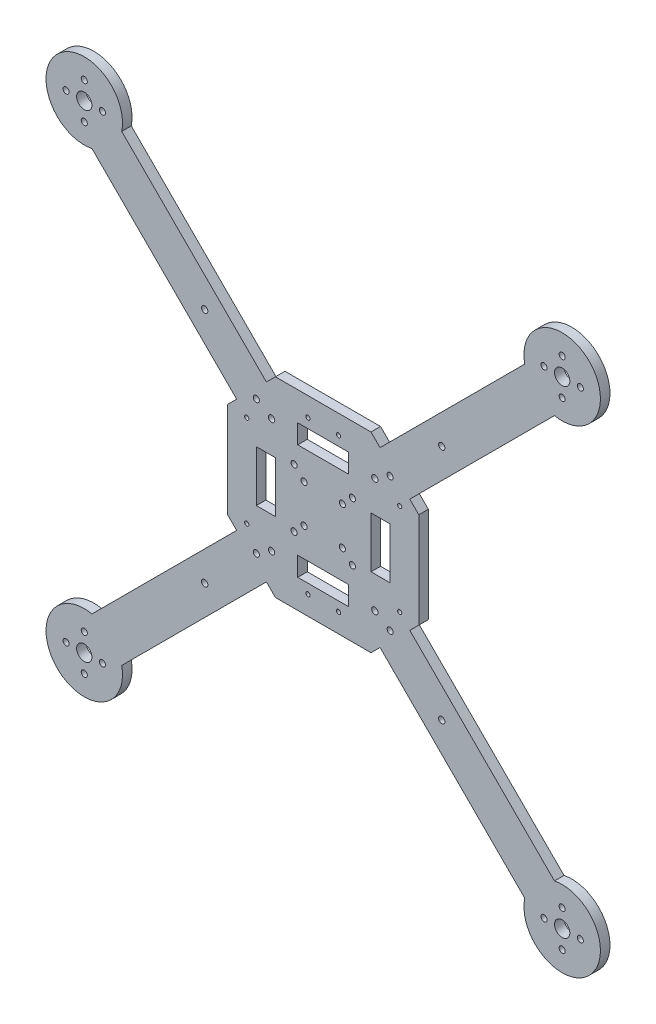
from build123d import *

# Parameters (mm, degrees)
EXTRUDE_246_DEPTH       = 5
EXTRUDE_363_DEPTH       = 5
SKETCH_3_R              = 20
EXTRUDE_433_DEPTH       = 5
SKETCH_4_R              = 4
SKETCH_4_R_2            = 1.6
SKETCH_4_R_3            = 1.1
CUT_EXTRUDE_574_DEPTH   = 5
SKETCH_5_R              = 1.1
CUT_EXTRUDE_636_DEPTH   = 5
SKETCH_7_R              = 1.65
CUT_EXTRUDE_M3_DEPTH    = 5
SKETCH_8_R              = 1.65
PIXHAWK_M3_54X60_DEPTH  = 5
SKETCH_9_W              = 10
SKETCH_9_H              = 26.682090866
SKETCH_9_W_2            = 26.682090866
SKETCH_9_H_2            = 10
CUT_EXTRUDE_20X12_DEPTH = 5


with BuildPart() as part:
    # 草图1 → Extrude 246 (new body)
    with BuildSketch(Plane.XY):
        Polygon((50, 25), (25, 50), (-25, 50), (-50, 25), (-50, -25), (-25, -50), (25, -50), (50, -25), align=None)
    extrude(amount=EXTRUDE_246_DEPTH)

    # 草图2 → Extrude 363 (add)
    with BuildSketch(Plane.XY):
        Polygon((14.849242405, 30.405591591), (120.050252532, 135.606601718), (135.606601718, 120.050252532), (30.405591591, 14.849242405), align=None)
        Polygon((-30.405591591, 14.849242405), (-135.606601718, 120.050252532), (-120.050252532, 135.606601718), (-14.849242405, 30.405591591), align=None)
        Polygon((-14.849242405, -30.405591591), (-120.050252532, -135.606601718), (-135.606601718, -120.050252532), (-30.405591591, -14.849242405), align=None)
        Polygon((30.405591591, -14.849242405), (135.606601718, -120.050252532), (120.050252532, -135.606601718), (14.849242405, -30.405591591), align=None)
    extrude(amount=EXTRUDE_363_DEPTH)

    # 草图3 → Extrude 433 (add)
    with BuildSketch(Plane.XY):
        with Locations((-125, -125)):
            Circle(SKETCH_3_R)
        with Locations((-125, 125)):
            Circle(SKETCH_3_R)
        with Locations((125, -125)):
            Circle(SKETCH_3_R)
        with Locations((125, 125)):
            Circle(SKETCH_3_R)
    extrude(amount=EXTRUDE_433_DEPTH)

    # 草图4 → Cut-Extrude 574 (cut)
    with BuildSketch(Plane.XY):
        with Locations((-125, -125)):
            Circle(SKETCH_4_R)
        with Locations((-35, -35)):
            Circle(SKETCH_4_R_2)
        with Locations((-8, -40)):
            Circle(SKETCH_4_R_3)
        with Locations((-125, 125)):
            Circle(SKETCH_4_R)
        with Locations((-35, 35)):
            Circle(SKETCH_4_R_2)
        with Locations((-8, 40)):
            Circle(SKETCH_4_R_3)
        with Locations((125, -125)):
            Circle(SKETCH_4_R)
        with Locations((35, -35)):
            Circle(SKETCH_4_R_2)
        with Locations((8, -40)):
            Circle(SKETCH_4_R_3)
        with Locations((125, 125)):
            Circle(SKETCH_4_R)
        with Locations((35, 35)):
            Circle(SKETCH_4_R_2)
        with Locations((8, 40)):
            Circle(SKETCH_4_R_3)
        with Locations((-15.25, -15.25)):
            Circle(SKETCH_4_R_2)
        with Locations((-15.25, 15.25)):
            Circle(SKETCH_4_R_2)
        with Locations((15.25, -15.25)):
            Circle(SKETCH_4_R_2)
        with Locations((15.25, 15.25)):
            Circle(SKETCH_4_R_2)
        with Locations((-10, -10)):
            Circle(SKETCH_4_R_2)
        with Locations((-10, 10)):
            Circle(SKETCH_4_R_2)
        with Locations((10, -10)):
            Circle(SKETCH_4_R_2)
        with Locations((10, 10)):
            Circle(SKETCH_4_R_2)
        with Locations((-134.5, -125)):
            Circle(SKETCH_4_R_2)
        with Locations((-125, -134.5)):
            Circle(SKETCH_4_R_2)
        with Locations((-115.5, -125)):
            Circle(SKETCH_4_R_2)
        with Locations((-125, -115.5)):
            Circle(SKETCH_4_R_2)
        with Locations((-134.5, 125)):
            Circle(SKETCH_4_R_2)
        with Locations((-125, 115.5)):
            Circle(SKETCH_4_R_2)
        with Locations((-115.5, 125)):
            Circle(SKETCH_4_R_2)
        with Locations((-125, 134.5)):
            Circle(SKETCH_4_R_2)
        with Locations((115.5, -125)):
            Circle(SKETCH_4_R_2)
        with Locations((125, -134.5)):
            Circle(SKETCH_4_R_2)
        with Locations((134.5, -125)):
            Circle(SKETCH_4_R_2)
        with Locations((125, -115.5)):
            Circle(SKETCH_4_R_2)
        with Locations((115.5, 125)):
            Circle(SKETCH_4_R_2)
        with Locations((125, 115.5)):
            Circle(SKETCH_4_R_2)
        with Locations((134.5, 125)):
            Circle(SKETCH_4_R_2)
        with Locations((125, 134.5)):
            Circle(SKETCH_4_R_2)
    extrude(amount=CUT_EXTRUDE_574_DEPTH, mode=Mode.SUBTRACT)

    # 草图5 → Cut-Extrude 636 (cut)
    with BuildSketch(Plane.XY):
        with Locations((-40, -24)):
            Circle(SKETCH_5_R)
        with Locations((-40, 24)):
            Circle(SKETCH_5_R)
        with Locations((40, -24)):
            Circle(SKETCH_5_R)
        with Locations((40, 24)):
            Circle(SKETCH_5_R)
    extrude(amount=CUT_EXTRUDE_636_DEPTH, mode=Mode.SUBTRACT)

    # 草图7 → 托板机臂中线四孔_M3 (cut)
    with BuildSketch(Plane.XY):
        with Locations((-62, -62)):
            Circle(SKETCH_7_R)
        with Locations((-62, 62)):
            Circle(SKETCH_7_R)
        with Locations((62, -62)):
            Circle(SKETCH_7_R)
        with Locations((62, 62)):
            Circle(SKETCH_7_R)
    extrude(amount=CUT_EXTRUDE_M3_DEPTH, mode=Mode.SUBTRACT)

    # 草图8 → Pixhawk托板支柱四孔_M3_54x60 (cut)
    with BuildSketch(Plane.XY):
        with Locations((-27, -30)):
            Circle(SKETCH_8_R)
        with Locations((-27, 30)):
            Circle(SKETCH_8_R)
        with Locations((27, -30)):
            Circle(SKETCH_8_R)
        with Locations((27, 30)):
            Circle(SKETCH_8_R)
    extrude(amount=PIXHAWK_M3_54X60_DEPTH, mode=Mode.SUBTRACT)

    # 草图9 → 飞控至电调矩形走线孔_20x12 (cut)
    with BuildSketch(Plane.XY):
        with Locations((-30, 0)):
            Rectangle(SKETCH_9_W, SKETCH_9_H)
        with Locations((0, -30)):
            Rectangle(SKETCH_9_W_2, SKETCH_9_H_2)
        with Locations((30, 0)):
            Rectangle(SKETCH_9_W, SKETCH_9_H)
        with Locations((0, 30)):
            Rectangle(SKETCH_9_W_2, SKETCH_9_H_2)
    extrude(amount=CUT_EXTRUDE_20X12_DEPTH, mode=Mode.SUBTRACT)


solid = part.part
